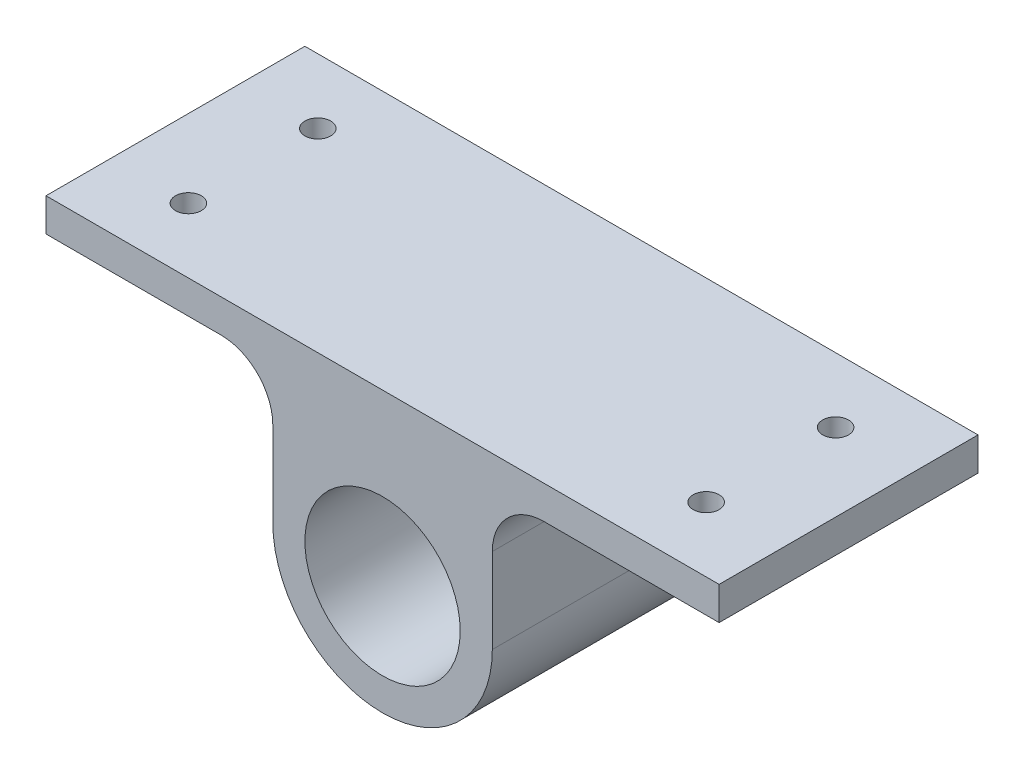
from build123d import *

# Parameters (mm, degrees)
SKETCH1_R           = 75
BOSS_EXTRUDE1_DEPTH = 125
FILLET1_R           = 50
SKETCH2_R           = 12.5
CUT_EXTRUDE1_DEPTH  = 441.624556737


with BuildPart() as part:
    # Sketch1 → Boss-Extrude1 (new, symmetric)
    with BuildSketch(Plane.XY):
        with BuildLine():
            Line((-106, 0), (-106, 132))
            Line((-106, 132), (-325, 132))
            Line((-325, 132), (-325, 164))
            Line((-325, 164), (325, 164))
            Line((325, 164), (325, 132))
            Line((325, 132), (106, 132))
            Line((106, 132), (106, 0))
            ThreePointArc((106, 0), (0, -106), (-106, 0))
        make_face()
        Circle(SKETCH1_R, mode=Mode.SUBTRACT)
    extrude(amount=BOSS_EXTRUDE1_DEPTH, both=True)

    # Fillet1
    fillet1_edges = [part.edges().sort_by_distance(p)[0] for p in [
        (106, 132, 0),
        (-106, 132, 0),
    ]]
    fillet(fillet1_edges, radius=FILLET1_R)

    # Sketch2 → Cut-Extrude1 (cut, through all)
    with BuildSketch(Plane(origin=(0, 164, 0), x_dir=(1, 0, 0), z_dir=(0, 1, 0))):
        with Locations(Location((-250, 62.5, 0), (0, 0, 180))):
            Circle(SKETCH2_R)
        with Locations(Location((-250, -62.5, 0), (0, 0, 180))):
            Circle(SKETCH2_R)
        with Locations(Location((250, -62.5, 0), (0, 0, 180))):
            Circle(SKETCH2_R)
        with Locations(Location((250, 62.5, 0), (0, 0, 180))):
            Circle(SKETCH2_R)
    extrude(amount=-CUT_EXTRUDE1_DEPTH, mode=Mode.SUBTRACT)


solid = part.part
